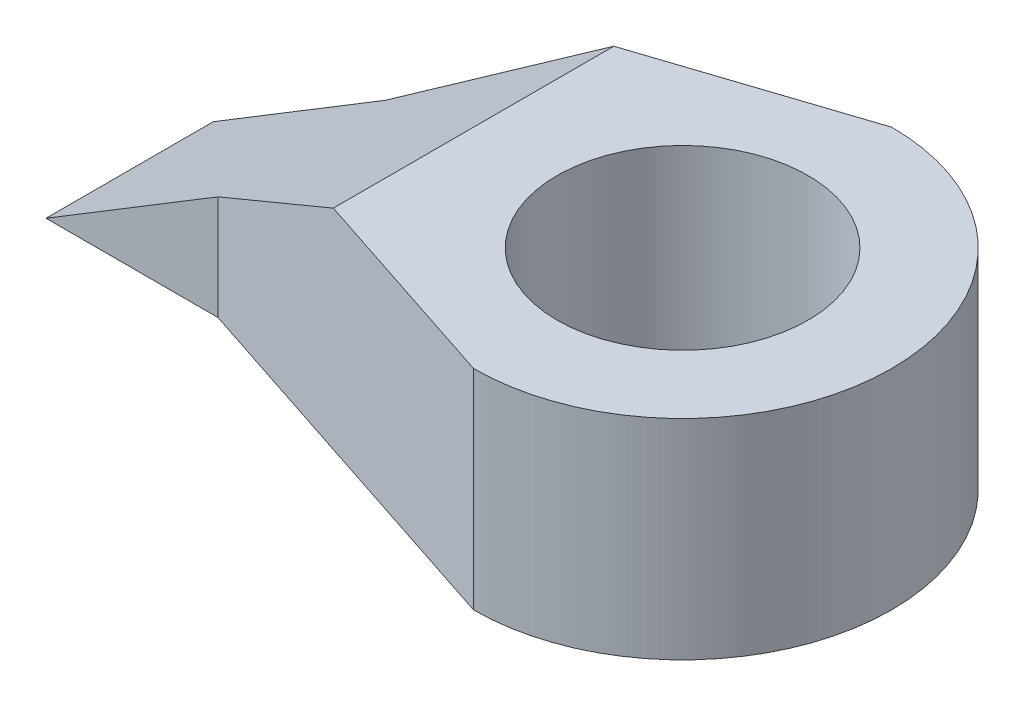
from build123d import *

# Parameters (mm, degrees)
BOSS_EXTRUDE4_DEPTH = 4
BOSS_EXTRUDE6_DEPTH = 5
CUT_EXTRUDE1_REACH  = 22.155
CUT_EXTRUDE2_REACH  = 22.155
SKETCH9_R           = 3


with BuildPart() as part:
    # Sketch1 → Boss-Extrude4 (new body)
    with BuildSketch(Plane.XY):
        Polygon((0, 0), (8.226600985, 5), (8.226600985, 0), align=None)
    extrude(amount=BOSS_EXTRUDE4_DEPTH)

    # Sketch7 → Boss-Extrude6 (add)
    with BuildSketch(Plane(origin=(0, 0, 0), x_dir=(1, 0, 0), z_dir=(0, 1, 0))):
        with BuildLine():
            Line((13.226600985, 3), (4.113300493, 0))
            Line((4.113300493, 0), (8.226600985, 0))
            Line((8.226600985, 0), (8.226600985, -4))
            Line((8.226600985, -4), (4.113300493, -4))
            Line((4.113300493, -4), (13.226600985, -7))
            ThreePointArc((13.226600985, -7), (18.226600985, -2), (13.226600985, 3))
        make_face()
    extrude(amount=BOSS_EXTRUDE6_DEPTH)

    # Sketch8 → Cut-Extrude1 (cut, up to next)
    with BuildSketch(Plane.XY, mode=Mode.PRIVATE) as cut_extrude1_sk1:
        Polygon((4.113300493, 2.5), (4.113300493, 5), (8.226600985, 5), align=None)
    cut_extrude1_tool1 = extrude(cut_extrude1_sk1.sketch, amount=-CUT_EXTRUDE1_REACH, mode=Mode.PRIVATE) & part.part
    cut_extrude1 = cut_extrude1_tool1.solids().sort_by_distance((5.484401, 4.166667, 0))[0]
    add(cut_extrude1, mode=Mode.SUBTRACT)

    # Mirror1: Cut-Extrude1 across plane
    add(cut_extrude1.mirror(Plane.XY.offset(2)), mode=Mode.SUBTRACT)

    # Sketch9 → Cut-Extrude2 (cut, up to next)
    with BuildSketch(Plane(origin=(0, 5, 0), x_dir=(1, 0, 0), z_dir=(0, 1, 0)), mode=Mode.PRIVATE) as cut_extrude2_sk1:
        with Locations(Location((13.226600985, -2, 0), (0, 0, 270))):
            Circle(SKETCH9_R)
    cut_extrude2_tool1 = extrude(cut_extrude2_sk1.sketch, amount=-CUT_EXTRUDE2_REACH, mode=Mode.PRIVATE) & part.part
    add(cut_extrude2_tool1.solids().sort_by_distance((13.226601, 5, 2))[0], mode=Mode.SUBTRACT)


solid = part.part
